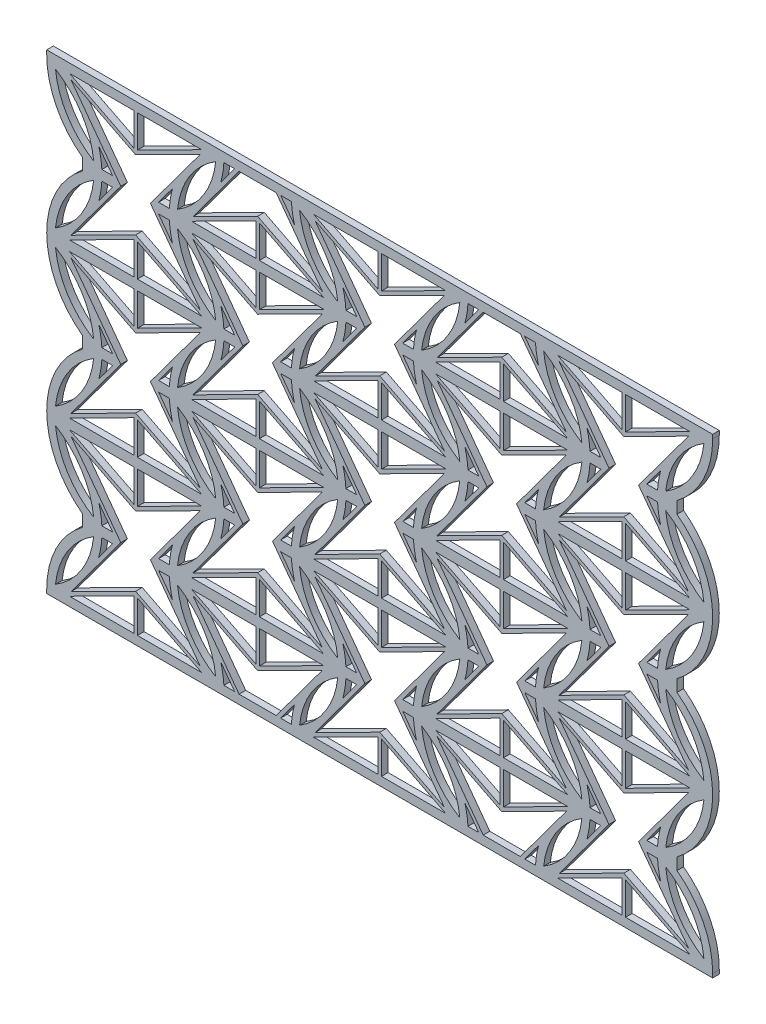
from build123d import *

# Parameters (mm, degrees)
BOSS_EXTRUDE1_DEPTH = 1.2


with BuildPart() as part:
    # Sketch1 → Boss-Extrude1 (new body)
    with BuildSketch(Plane.XY):
        with BuildLine():
            Line((-16.888522067, -14.63324126), (-16.888522067, -15.349692912))
            Line((-16.888522067, -15.349692912), (15.311477933, -15.349692912))
            Line((15.311477933, -15.349692912), (27.326374873, -15.349692912))
            Line((27.326374873, -15.349692912), (59.526374873, -15.349692912))
            Line((59.526374873, -15.349692912), (71.541271813, -15.349692912))
            Line((71.541271813, -15.349692912), (103.741271813, -15.349692912))
            Line((103.741271813, -15.349692912), (103.741271813, -14.63324126))
            ThreePointArc((103.741271813, -14.63324126), (102.035545018, -7.42110573), (97.279793689, -1.737160613))
            Line((97.279793689, -1.737160613), (97.279793689, 0.422957167))
            ThreePointArc((97.279793689, 0.422957167), (102.035545018, 6.106902284), (103.741271813, 13.319037814))
            ThreePointArc((103.741271813, 13.319037814), (102.035545018, 20.531173344), (97.279793689, 26.215118461))
            Line((97.279793689, 26.215118461), (97.279793689, 28.375236241))
            ThreePointArc((97.279793689, 28.375236241), (102.035545018, 34.059181358), (103.741271813, 41.271316888))
            ThreePointArc((103.741271813, 41.271316888), (102.035545018, 48.483452418), (97.279793689, 54.167397535))
            Line((97.279793689, 54.167397535), (97.279793689, 56.327515315))
            ThreePointArc((97.279793689, 56.327515315), (102.035545018, 62.011460432), (103.741271813, 69.223595962))
            Line((103.741271813, 69.223595962), (103.741271813, 69.940047614))
            Line((103.741271813, 69.940047614), (71.541271813, 69.940047614))
            Line((71.541271813, 69.940047614), (59.526374873, 69.940047614))
            Line((59.526374873, 69.940047614), (27.326374873, 69.940047614))
            Line((27.326374873, 69.940047614), (15.311477933, 69.940047614))
            Line((15.311477933, 69.940047614), (-16.888522067, 69.940047614))
            Line((-16.888522067, 69.940047614), (-16.888522067, 69.223595962))
            ThreePointArc((-16.888522067, 69.223595962), (-15.182795272, 62.011460432), (-10.427043943, 56.327515315))
            Line((-10.427043943, 56.327515315), (-10.427043943, 54.167397535))
            ThreePointArc((-10.427043943, 54.167397535), (-15.182795272, 48.483452418), (-16.888522067, 41.271316888))
            ThreePointArc((-16.888522067, 41.271316888), (-15.182795272, 34.059181358), (-10.427043943, 28.375236241))
            Line((-10.427043943, 28.375236241), (-10.427043943, 26.215118461))
            ThreePointArc((-10.427043943, 26.215118461), (-15.182795272, 20.531173344), (-16.888522067, 13.319037814))
            ThreePointArc((-16.888522067, 13.319037814), (-15.182795272, 6.106902284), (-10.427043943, 0.422957167))
            Line((-10.427043943, 0.422957167), (-10.427043943, -1.737160613))
            ThreePointArc((-10.427043943, -1.737160613), (-15.182795272, -7.42110573), (-16.888522067, -14.63324126))
        make_face()
        with BuildLine():
            Line((3.377612022, -1.575633744), (5.326519848, -1.575633744))
            ThreePointArc((5.326519848, -1.575633744), (5.517908163, -3.289323422), (5.892390802, -4.972512228))
            Line((5.892390802, -4.972512228), (3.377612022, -1.575633744))
        make_face(mode=Mode.SUBTRACT)
        with BuildLine():
            Line((-4.954656156, -1.575633744), (-6.903563983, -1.575633744))
            ThreePointArc((-6.903563983, -1.575633744), (-7.094952298, -3.289323422), (-7.469434937, -4.972512228))
            Line((-7.469434937, -4.972512228), (-4.954656156, -1.575633744))
        make_face(mode=Mode.SUBTRACT)
        with BuildLine():
            Line((-4.954656156, 0.261430299), (-7.469434937, 3.658308782))
            ThreePointArc((-7.469434937, 3.658308782), (-7.094952298, 1.975119977), (-6.903563983, 0.261430299))
            Line((-6.903563983, 0.261430299), (-4.954656156, 0.261430299))
        make_face(mode=Mode.SUBTRACT)
        Polygon((11.175521023, 12.400505793), (-0.465082292, 12.400505793), (-0.465082292, 6.521256719), align=None, mode=Mode.SUBTRACT)
        with BuildLine():
            Line((3.377612022, 0.261430299), (5.892390802, 3.658308782))
            ThreePointArc((5.892390802, 3.658308782), (5.517908163, 1.975119977), (5.326519848, 0.261430299))
            Line((5.326519848, 0.261430299), (3.377612022, 0.261430299))
        make_face(mode=Mode.SUBTRACT)
        Polygon((-1.111961843, 6.521256719), (-12.752565158, 12.400505793), (-1.111961843, 12.400505793), align=None, mode=Mode.SUBTRACT)
        Polygon((-0.788522067, -6.94739817), (10.931987496, -12.867005009), (1.89274578, -0.657101723), (10.931987496, 11.552801564), (-0.788522067, 5.633194724), (-12.509031631, 11.552801564), (-3.469789914, -0.657101723), (-12.509031631, -12.867005009), align=None, mode=Mode.SUBTRACT)
        Polygon((-0.465082292, -7.835460164), (11.175521023, -13.714709238), (-0.465082292, -13.714709238), align=None, mode=Mode.SUBTRACT)
        Polygon((-1.111961843, -13.714709238), (-1.111961843, -7.835460164), (-12.752565158, -13.714709238), align=None, mode=Mode.SUBTRACT)
        with BuildLine():
            Line((25.485060492, 14.237569836), (27.433968319, 14.237569836))
            ThreePointArc((27.433968319, 14.237569836), (27.625356634, 15.951259514), (27.999839272, 17.634448319))
            Line((27.999839272, 17.634448319), (25.485060492, 14.237569836))
        make_face(mode=Mode.SUBTRACT)
        Polygon((33.282969493, 0.261430299), (21.642366179, 0.261430299), (21.642366179, 6.140679373), align=None, mode=Mode.SUBTRACT)
        Polygon((21.318926403, 19.609334261), (9.598416839, 25.528941101), (18.637658556, 13.319037814), (9.598416839, 1.109134527), (21.318926403, 7.028741367), (33.039435966, 1.109134527), (24.00019425, 13.319037814), (33.039435966, 25.528941101), align=None, mode=Mode.SUBTRACT)
        with BuildLine():
            Line((17.152792314, 14.237569836), (15.203884487, 14.237569836))
            ThreePointArc((15.203884487, 14.237569836), (15.012496172, 15.951259514), (14.638013534, 17.634448319))
            Line((14.638013534, 17.634448319), (17.152792314, 14.237569836))
        make_face(mode=Mode.SUBTRACT)
        Polygon((20.995486627, 0.261430299), (9.354883312, 0.261430299), (20.995486627, 6.140679373), align=None, mode=Mode.SUBTRACT)
        with BuildLine():
            Line((17.152792314, 12.400505793), (15.203884487, 12.400505793))
            ThreePointArc((15.203884487, 12.400505793), (15.012496172, 10.686816114), (14.638013534, 9.003627309))
            Line((14.638013534, 9.003627309), (17.152792314, 12.400505793))
        make_face(mode=Mode.SUBTRACT)
        with BuildLine():
            Line((25.485060492, 12.400505793), (27.433968319, 12.400505793))
            ThreePointArc((27.433968319, 12.400505793), (27.625356634, 10.686816114), (27.999839272, 9.003627309))
            Line((27.999839272, 9.003627309), (25.485060492, 12.400505793))
        make_face(mode=Mode.SUBTRACT)
        Polygon((33.282969493, 26.376645329), (21.642366179, 26.376645329), (21.642366179, 20.497396255), align=None, mode=Mode.SUBTRACT)
        Polygon((20.995486627, 20.497396255), (9.354883312, 26.376645329), (20.995486627, 26.376645329), align=None, mode=Mode.SUBTRACT)
        with BuildLine():
            Line((47.592508962, 28.213709372), (49.541416789, 28.213709372))
            ThreePointArc((49.541416789, 28.213709372), (49.732805104, 29.927399051), (50.107287742, 31.610587856))
            Line((50.107287742, 31.610587856), (47.592508962, 28.213709372))
        make_face(mode=Mode.SUBTRACT)
        Polygon((55.390417964, 14.237569836), (43.749814649, 14.237569836), (43.749814649, 20.11681891), align=None, mode=Mode.SUBTRACT)
        Polygon((43.426374873, 33.585473798), (31.705865309, 39.505080638), (40.745107026, 27.295177351), (31.705865309, 15.085274064), (43.426374873, 21.004880904), (55.146884437, 15.085274064), (46.10764272, 27.295177351), (55.146884437, 39.505080638), align=None, mode=Mode.SUBTRACT)
        with BuildLine():
            Line((39.260240784, 28.213709372), (37.311332957, 28.213709372))
            ThreePointArc((37.311332957, 28.213709372), (37.119944642, 29.927399051), (36.745462004, 31.610587856))
            Line((36.745462004, 31.610587856), (39.260240784, 28.213709372))
        make_face(mode=Mode.SUBTRACT)
        Polygon((43.102935097, 14.237569836), (31.462331782, 14.237569836), (43.102935097, 20.11681891), align=None, mode=Mode.SUBTRACT)
        with BuildLine():
            Line((39.260240784, 26.376645329), (37.311332957, 26.376645329))
            ThreePointArc((37.311332957, 26.376645329), (37.119944642, 24.662955651), (36.745462004, 22.979766846))
            Line((36.745462004, 22.979766846), (39.260240784, 26.376645329))
        make_face(mode=Mode.SUBTRACT)
        with BuildLine():
            Line((47.592508962, 26.376645329), (49.541416789, 26.376645329))
            ThreePointArc((49.541416789, 26.376645329), (49.732805104, 24.662955651), (50.107287742, 22.979766846))
            Line((50.107287742, 22.979766846), (47.592508962, 26.376645329))
        make_face(mode=Mode.SUBTRACT)
        Polygon((55.390417964, 40.352784866), (43.749814649, 40.352784866), (43.749814649, 34.473535792), align=None, mode=Mode.SUBTRACT)
        Polygon((43.102935097, 34.473535792), (31.462331782, 40.352784866), (43.102935097, 40.352784866), align=None, mode=Mode.SUBTRACT)
        with BuildLine():
            Line((69.699957432, 42.189848909), (71.648865259, 42.189848909))
            ThreePointArc((71.648865259, 42.189848909), (71.840253574, 43.903538587), (72.214736212, 45.586727393))
            Line((72.214736212, 45.586727393), (69.699957432, 42.189848909))
        make_face(mode=Mode.SUBTRACT)
        Polygon((77.497866434, 28.213709372), (65.857263119, 28.213709372), (65.857263119, 34.092958446), align=None, mode=Mode.SUBTRACT)
        Polygon((65.533823343, 47.561613335), (53.81331378, 53.481220174), (62.852555496, 41.271316888), (53.81331378, 29.061413601), (65.533823343, 34.981020441), (77.254332907, 29.061413601), (68.21509119, 41.271316888), (77.254332907, 53.481220174), align=None, mode=Mode.SUBTRACT)
        with BuildLine():
            Line((61.367689254, 42.189848909), (59.418781427, 42.189848909))
            ThreePointArc((59.418781427, 42.189848909), (59.227393112, 43.903538587), (58.852910474, 45.586727393))
            Line((58.852910474, 45.586727393), (61.367689254, 42.189848909))
        make_face(mode=Mode.SUBTRACT)
        Polygon((65.210383567, 28.213709372), (53.569780253, 28.213709372), (65.210383567, 34.092958446), align=None, mode=Mode.SUBTRACT)
        with BuildLine():
            Line((61.367689254, 40.352784866), (59.418781427, 40.352784866))
            ThreePointArc((59.418781427, 40.352784866), (59.227393112, 38.639095188), (58.852910474, 36.955906383))
            Line((58.852910474, 36.955906383), (61.367689254, 40.352784866))
        make_face(mode=Mode.SUBTRACT)
        with BuildLine():
            Line((69.699957432, 40.352784866), (71.648865259, 40.352784866))
            ThreePointArc((71.648865259, 40.352784866), (71.840253574, 38.639095188), (72.214736212, 36.955906383))
            Line((72.214736212, 36.955906383), (69.699957432, 40.352784866))
        make_face(mode=Mode.SUBTRACT)
        Polygon((77.497866434, 54.328924403), (65.857263119, 54.328924403), (65.857263119, 48.449675329), align=None, mode=Mode.SUBTRACT)
        Polygon((65.210383567, 48.449675329), (53.569780253, 54.328924403), (65.210383567, 54.328924403), align=None, mode=Mode.SUBTRACT)
        with BuildLine():
            Line((91.807405902, 56.165988446), (93.756313729, 56.165988446))
            ThreePointArc((93.756313729, 56.165988446), (93.947702044, 57.879678124), (94.322184683, 59.56286693))
            Line((94.322184683, 59.56286693), (91.807405902, 56.165988446))
        make_face(mode=Mode.SUBTRACT)
        Polygon((99.605314904, 42.189848909), (87.964711589, 42.189848909), (87.964711589, 48.069097983), align=None, mode=Mode.SUBTRACT)
        Polygon((87.641271813, 61.537752872), (75.92076225, 67.457359711), (84.960003967, 55.247456425), (75.92076225, 43.037553138), (87.641271813, 48.957159978), (99.361781377, 43.037553138), (90.32253966, 55.247456425), (99.361781377, 67.457359711), align=None, mode=Mode.SUBTRACT)
        with BuildLine():
            Line((83.475137724, 56.165988446), (81.526229898, 56.165988446))
            ThreePointArc((81.526229898, 56.165988446), (81.334841583, 57.879678124), (80.960358944, 59.56286693))
            Line((80.960358944, 59.56286693), (83.475137724, 56.165988446))
        make_face(mode=Mode.SUBTRACT)
        Polygon((87.317832038, 42.189848909), (75.677228723, 42.189848909), (87.317832038, 48.069097983), align=None, mode=Mode.SUBTRACT)
        with BuildLine():
            Line((83.475137724, 54.328924403), (81.526229898, 54.328924403))
            ThreePointArc((81.526229898, 54.328924403), (81.334841583, 52.615234725), (80.960358944, 50.93204592))
            Line((80.960358944, 50.93204592), (83.475137724, 54.328924403))
        make_face(mode=Mode.SUBTRACT)
        with BuildLine():
            Line((91.807405902, 54.328924403), (93.756313729, 54.328924403))
            ThreePointArc((93.756313729, 54.328924403), (93.947702044, 52.615234725), (94.322184683, 50.93204592))
            Line((94.322184683, 50.93204592), (91.807405902, 54.328924403))
        make_face(mode=Mode.SUBTRACT)
        Polygon((99.605314904, 68.30506394), (87.964711589, 68.30506394), (87.964711589, 62.425814866), align=None, mode=Mode.SUBTRACT)
        Polygon((87.317832038, 62.425814866), (75.677228723, 68.30506394), (87.317832038, 68.30506394), align=None, mode=Mode.SUBTRACT)
        Polygon((20.995486627, 48.449675329), (9.354883312, 54.328924403), (20.995486627, 54.328924403), align=None, mode=Mode.SUBTRACT)
        with BuildLine():
            Line((17.152792314, 40.352784866), (15.203884487, 40.352784866))
            ThreePointArc((15.203884487, 40.352784866), (15.012496172, 38.639095188), (14.638013534, 36.955906383))
            Line((14.638013534, 36.955906383), (17.152792314, 40.352784866))
        make_face(mode=Mode.SUBTRACT)
        Polygon((21.642366179, 54.328924403), (21.642366179, 48.449675329), (33.282969493, 54.328924403), align=None, mode=Mode.SUBTRACT)
        Polygon((33.282969493, 28.213709372), (21.642366179, 28.213709372), (21.642366179, 34.092958446), align=None, mode=Mode.SUBTRACT)
        Polygon((21.318926403, 34.981020441), (33.039435966, 29.061413601), (24.00019425, 41.271316888), (33.039435966, 53.481220174), (21.318926403, 47.561613335), (9.598416839, 53.481220174), (18.637658556, 41.271316888), (9.598416839, 29.061413601), align=None, mode=Mode.SUBTRACT)
        with BuildLine():
            Line((17.152792314, 42.189848909), (15.203884487, 42.189848909))
            ThreePointArc((15.203884487, 42.189848909), (15.012496172, 43.903538587), (14.638013534, 45.586727393))
            Line((14.638013534, 45.586727393), (17.152792314, 42.189848909))
        make_face(mode=Mode.SUBTRACT)
        with BuildLine():
            Line((25.485060492, 40.352784866), (27.433968319, 40.352784866))
            ThreePointArc((27.433968319, 40.352784866), (27.625356634, 38.639095188), (27.999839272, 36.955906383))
            Line((27.999839272, 36.955906383), (25.485060492, 40.352784866))
        make_face(mode=Mode.SUBTRACT)
        Polygon((20.995486627, 34.092958446), (9.354883312, 28.213709372), (20.995486627, 28.213709372), align=None, mode=Mode.SUBTRACT)
        with BuildLine():
            Line((25.485060492, 42.189848909), (27.433968319, 42.189848909))
            ThreePointArc((27.433968319, 42.189848909), (27.625356634, 43.903538587), (27.999839272, 45.586727393))
            Line((27.999839272, 45.586727393), (25.485060492, 42.189848909))
        make_face(mode=Mode.SUBTRACT)
        Polygon((43.102935097, 62.425814866), (31.462331782, 68.30506394), (43.102935097, 68.30506394), align=None, mode=Mode.SUBTRACT)
        with BuildLine():
            Line((39.260240784, 54.328924403), (37.311332957, 54.328924403))
            ThreePointArc((37.311332957, 54.328924403), (37.119944642, 52.615234725), (36.745462004, 50.93204592))
            Line((36.745462004, 50.93204592), (39.260240784, 54.328924403))
        make_face(mode=Mode.SUBTRACT)
        Polygon((43.749814649, 68.30506394), (43.749814649, 62.425814866), (55.390417964, 68.30506394), align=None, mode=Mode.SUBTRACT)
        Polygon((55.390417964, 42.189848909), (43.749814649, 42.189848909), (43.749814649, 48.069097983), align=None, mode=Mode.SUBTRACT)
        Polygon((43.426374873, 48.957159978), (55.146884437, 43.037553138), (46.10764272, 55.247456425), (55.146884437, 67.457359711), (43.426374873, 61.537752872), (31.705865309, 67.457359711), (40.745107026, 55.247456425), (31.705865309, 43.037553138), align=None, mode=Mode.SUBTRACT)
        with BuildLine():
            Line((39.260240784, 56.165988446), (37.311332957, 56.165988446))
            ThreePointArc((37.311332957, 56.165988446), (37.119944642, 57.879678124), (36.745462004, 59.56286693))
            Line((36.745462004, 59.56286693), (39.260240784, 56.165988446))
        make_face(mode=Mode.SUBTRACT)
        with BuildLine():
            Line((47.592508962, 54.328924403), (49.541416789, 54.328924403))
            ThreePointArc((49.541416789, 54.328924403), (49.732805104, 52.615234725), (50.107287742, 50.93204592))
            Line((50.107287742, 50.93204592), (47.592508962, 54.328924403))
        make_face(mode=Mode.SUBTRACT)
        Polygon((43.102935097, 48.069097983), (31.462331782, 42.189848909), (43.102935097, 42.189848909), align=None, mode=Mode.SUBTRACT)
        with BuildLine():
            Line((47.592508962, 56.165988446), (49.541416789, 56.165988446))
            ThreePointArc((49.541416789, 56.165988446), (49.732805104, 57.879678124), (50.107287742, 59.56286693))
            Line((50.107287742, 59.56286693), (47.592508962, 56.165988446))
        make_face(mode=Mode.SUBTRACT)
        with BuildLine():
            Line((61.367689254, 68.30506394), (59.418781427, 68.30506394))
            ThreePointArc((59.418781427, 68.30506394), (59.227393112, 66.591374262), (58.852910474, 64.908185457))
            Line((58.852910474, 64.908185457), (61.367689254, 68.30506394))
        make_face(mode=Mode.SUBTRACT)
        Polygon((77.497866434, 56.165988446), (65.857263119, 56.165988446), (65.857263119, 62.04523752), align=None, mode=Mode.SUBTRACT)
        Polygon((65.533823343, 62.933299515), (77.254332907, 57.013692675), (68.895099276, 68.30506394), (62.17254741, 68.30506394), (53.81331378, 57.013692675), align=None, mode=Mode.SUBTRACT)
        with BuildLine():
            Line((69.699957432, 68.30506394), (71.648865259, 68.30506394))
            ThreePointArc((71.648865259, 68.30506394), (71.840253574, 66.591374262), (72.214736212, 64.908185457))
            Line((72.214736212, 64.908185457), (69.699957432, 68.30506394))
        make_face(mode=Mode.SUBTRACT)
        Polygon((65.210383567, 62.04523752), (53.569780253, 56.165988446), (65.210383567, 56.165988446), align=None, mode=Mode.SUBTRACT)
        Polygon((-1.111961843, 34.473535792), (-12.752565158, 40.352784866), (-1.111961843, 40.352784866), align=None, mode=Mode.SUBTRACT)
        with BuildLine():
            Line((-4.954656156, 26.376645329), (-6.903563983, 26.376645329))
            ThreePointArc((-6.903563983, 26.376645329), (-7.094952298, 24.662955651), (-7.469434937, 22.979766846))
            Line((-7.469434937, 22.979766846), (-4.954656156, 26.376645329))
        make_face(mode=Mode.SUBTRACT)
        Polygon((-0.465082292, 40.352784866), (-0.465082292, 34.473535792), (11.175521023, 40.352784866), align=None, mode=Mode.SUBTRACT)
        Polygon((11.175521023, 14.237569836), (-0.465082292, 14.237569836), (-0.465082292, 20.11681891), align=None, mode=Mode.SUBTRACT)
        Polygon((-0.788522067, 21.004880904), (10.931987496, 15.085274064), (1.89274578, 27.295177351), (10.931987496, 39.505080638), (-0.788522067, 33.585473798), (-12.509031631, 39.505080638), (-3.469789914, 27.295177351), (-12.509031631, 15.085274064), align=None, mode=Mode.SUBTRACT)
        with BuildLine():
            Line((-4.954656156, 28.213709372), (-6.903563983, 28.213709372))
            ThreePointArc((-6.903563983, 28.213709372), (-7.094952298, 29.927399051), (-7.469434937, 31.610587856))
            Line((-7.469434937, 31.610587856), (-4.954656156, 28.213709372))
        make_face(mode=Mode.SUBTRACT)
        with BuildLine():
            Line((3.377612022, 26.376645329), (5.326519848, 26.376645329))
            ThreePointArc((5.326519848, 26.376645329), (5.517908163, 24.662955651), (5.892390802, 22.979766846))
            Line((5.892390802, 22.979766846), (3.377612022, 26.376645329))
        make_face(mode=Mode.SUBTRACT)
        Polygon((-1.111961843, 20.11681891), (-12.752565158, 14.237569836), (-1.111961843, 14.237569836), align=None, mode=Mode.SUBTRACT)
        with BuildLine():
            Line((3.377612022, 28.213709372), (5.326519848, 28.213709372))
            ThreePointArc((5.326519848, 28.213709372), (5.517908163, 29.927399051), (5.892390802, 31.610587856))
            Line((5.892390802, 31.610587856), (3.377612022, 28.213709372))
        make_face(mode=Mode.SUBTRACT)
        Polygon((-1.111961843, 62.425814866), (-12.752565158, 68.30506394), (-1.111961843, 68.30506394), align=None, mode=Mode.SUBTRACT)
        with BuildLine():
            Line((-4.954656156, 54.328924403), (-6.903563983, 54.328924403))
            ThreePointArc((-6.903563983, 54.328924403), (-7.094952298, 52.615234725), (-7.469434937, 50.93204592))
            Line((-7.469434937, 50.93204592), (-4.954656156, 54.328924403))
        make_face(mode=Mode.SUBTRACT)
        Polygon((-0.465082292, 68.30506394), (-0.465082292, 62.425814866), (11.175521023, 68.30506394), align=None, mode=Mode.SUBTRACT)
        Polygon((11.175521023, 42.189848909), (-0.465082292, 42.189848909), (-0.465082292, 48.069097983), align=None, mode=Mode.SUBTRACT)
        Polygon((-0.788522067, 48.957159978), (10.931987496, 43.037553138), (1.89274578, 55.247456425), (10.931987496, 67.457359711), (-0.788522067, 61.537752872), (-12.509031631, 67.457359711), (-3.469789914, 55.247456425), (-12.509031631, 43.037553138), align=None, mode=Mode.SUBTRACT)
        with BuildLine():
            Line((-4.954656156, 56.165988446), (-6.903563983, 56.165988446))
            ThreePointArc((-6.903563983, 56.165988446), (-7.094952298, 57.879678124), (-7.469434937, 59.56286693))
            Line((-7.469434937, 59.56286693), (-4.954656156, 56.165988446))
        make_face(mode=Mode.SUBTRACT)
        with BuildLine():
            Line((3.377612022, 54.328924403), (5.326519848, 54.328924403))
            ThreePointArc((5.326519848, 54.328924403), (5.517908163, 52.615234725), (5.892390802, 50.93204592))
            Line((5.892390802, 50.93204592), (3.377612022, 54.328924403))
        make_face(mode=Mode.SUBTRACT)
        Polygon((-1.111961843, 48.069097983), (-12.752565158, 42.189848909), (-1.111961843, 42.189848909), align=None, mode=Mode.SUBTRACT)
        with BuildLine():
            Line((3.377612022, 56.165988446), (5.326519848, 56.165988446))
            ThreePointArc((5.326519848, 56.165988446), (5.517908163, 57.879678124), (5.892390802, 59.56286693))
            Line((5.892390802, 59.56286693), (3.377612022, 56.165988446))
        make_face(mode=Mode.SUBTRACT)
        with BuildLine():
            Line((17.152792314, 68.30506394), (15.203884487, 68.30506394))
            ThreePointArc((15.203884487, 68.30506394), (15.012496172, 66.591374262), (14.638013534, 64.908185457))
            Line((14.638013534, 64.908185457), (17.152792314, 68.30506394))
        make_face(mode=Mode.SUBTRACT)
        Polygon((33.282969493, 56.165988446), (21.642366179, 56.165988446), (21.642366179, 62.04523752), align=None, mode=Mode.SUBTRACT)
        Polygon((21.318926403, 62.933299515), (33.039435966, 57.013692675), (24.680202336, 68.30506394), (17.95765047, 68.30506394), (9.598416839, 57.013692675), align=None, mode=Mode.SUBTRACT)
        with BuildLine():
            Line((25.485060492, 68.30506394), (27.433968319, 68.30506394))
            ThreePointArc((27.433968319, 68.30506394), (27.625356634, 66.591374262), (27.999839272, 64.908185457))
            Line((27.999839272, 64.908185457), (25.485060492, 68.30506394))
        make_face(mode=Mode.SUBTRACT)
        Polygon((20.995486627, 62.04523752), (9.354883312, 56.165988446), (20.995486627, 56.165988446), align=None, mode=Mode.SUBTRACT)
        with BuildLine():
            Line((39.260240784, 0.261430299), (36.745462004, 3.658308782))
            ThreePointArc((36.745462004, 3.658308782), (37.119944642, 1.975119977), (37.311332957, 0.261430299))
            Line((37.311332957, 0.261430299), (39.260240784, 0.261430299))
        make_face(mode=Mode.SUBTRACT)
        Polygon((43.102935097, -13.714709238), (43.102935097, -7.835460164), (31.462331782, -13.714709238), align=None, mode=Mode.SUBTRACT)
        Polygon((55.390417964, 12.400505793), (43.749814649, 12.400505793), (43.749814649, 6.521256719), align=None, mode=Mode.SUBTRACT)
        Polygon((43.749814649, -13.714709238), (43.749814649, -7.835460164), (55.390417964, -13.714709238), align=None, mode=Mode.SUBTRACT)
        with BuildLine():
            Line((39.260240784, -1.575633744), (36.745462004, -4.972512228))
            ThreePointArc((36.745462004, -4.972512228), (37.119944642, -3.289323422), (37.311332957, -1.575633744))
            Line((37.311332957, -1.575633744), (39.260240784, -1.575633744))
        make_face(mode=Mode.SUBTRACT)
        with BuildLine():
            Line((47.592508962, 0.261430299), (50.107287742, 3.658308782))
            ThreePointArc((50.107287742, 3.658308782), (49.732805104, 1.975119977), (49.541416789, 0.261430299))
            Line((49.541416789, 0.261430299), (47.592508962, 0.261430299))
        make_face(mode=Mode.SUBTRACT)
        Polygon((43.102935097, 12.400505793), (43.102935097, 6.521256719), (31.462331782, 12.400505793), align=None, mode=Mode.SUBTRACT)
        Polygon((55.146884437, -12.867005009), (46.10764272, -0.657101723), (55.146884437, 11.552801564), (43.426374873, 5.633194724), (31.705865309, 11.552801564), (40.745107026, -0.657101723), (31.705865309, -12.867005009), (43.426374873, -6.94739817), align=None, mode=Mode.SUBTRACT)
        with BuildLine():
            Line((47.592508962, -1.575633744), (49.541416789, -1.575633744))
            ThreePointArc((49.541416789, -1.575633744), (49.732805104, -3.289323422), (50.107287742, -4.972512228))
            Line((50.107287742, -4.972512228), (47.592508962, -1.575633744))
        make_face(mode=Mode.SUBTRACT)
        with BuildLine():
            Line((61.367689254, 14.237569836), (58.852910474, 17.634448319))
            ThreePointArc((58.852910474, 17.634448319), (59.227393112, 15.951259514), (59.418781427, 14.237569836))
            Line((59.418781427, 14.237569836), (61.367689254, 14.237569836))
        make_face(mode=Mode.SUBTRACT)
        Polygon((65.210383567, 0.261430299), (65.210383567, 6.140679373), (53.569780253, 0.261430299), align=None, mode=Mode.SUBTRACT)
        Polygon((77.497866434, 26.376645329), (65.857263119, 26.376645329), (65.857263119, 20.497396255), align=None, mode=Mode.SUBTRACT)
        Polygon((65.857263119, 0.261430299), (65.857263119, 6.140679373), (77.497866434, 0.261430299), align=None, mode=Mode.SUBTRACT)
        with BuildLine():
            Line((61.367689254, 12.400505793), (58.852910474, 9.003627309))
            ThreePointArc((58.852910474, 9.003627309), (59.227393112, 10.686816114), (59.418781427, 12.400505793))
            Line((59.418781427, 12.400505793), (61.367689254, 12.400505793))
        make_face(mode=Mode.SUBTRACT)
        with BuildLine():
            Line((69.699957432, 14.237569836), (72.214736212, 17.634448319))
            ThreePointArc((72.214736212, 17.634448319), (71.840253574, 15.951259514), (71.648865259, 14.237569836))
            Line((71.648865259, 14.237569836), (69.699957432, 14.237569836))
        make_face(mode=Mode.SUBTRACT)
        Polygon((65.210383567, 26.376645329), (65.210383567, 20.497396255), (53.569780253, 26.376645329), align=None, mode=Mode.SUBTRACT)
        Polygon((77.254332907, 1.109134527), (68.21509119, 13.319037814), (77.254332907, 25.528941101), (65.533823343, 19.609334261), (53.81331378, 25.528941101), (62.852555496, 13.319037814), (53.81331378, 1.109134527), (65.533823343, 7.028741367), align=None, mode=Mode.SUBTRACT)
        with BuildLine():
            Line((69.699957432, 12.400505793), (71.648865259, 12.400505793))
            ThreePointArc((71.648865259, 12.400505793), (71.840253574, 10.686816114), (72.214736212, 9.003627309))
            Line((72.214736212, 9.003627309), (69.699957432, 12.400505793))
        make_face(mode=Mode.SUBTRACT)
        with BuildLine():
            Line((83.475137724, 28.213709372), (80.960358944, 31.610587856))
            ThreePointArc((80.960358944, 31.610587856), (81.334841583, 29.927399051), (81.526229898, 28.213709372))
            Line((81.526229898, 28.213709372), (83.475137724, 28.213709372))
        make_face(mode=Mode.SUBTRACT)
        Polygon((87.317832038, 14.237569836), (87.317832038, 20.11681891), (75.677228723, 14.237569836), align=None, mode=Mode.SUBTRACT)
        Polygon((99.605314904, 40.352784866), (87.964711589, 40.352784866), (87.964711589, 34.473535792), align=None, mode=Mode.SUBTRACT)
        Polygon((87.964711589, 14.237569836), (87.964711589, 20.11681891), (99.605314904, 14.237569836), align=None, mode=Mode.SUBTRACT)
        with BuildLine():
            Line((83.475137724, 26.376645329), (80.960358944, 22.979766846))
            ThreePointArc((80.960358944, 22.979766846), (81.334841583, 24.662955651), (81.526229898, 26.376645329))
            Line((81.526229898, 26.376645329), (83.475137724, 26.376645329))
        make_face(mode=Mode.SUBTRACT)
        with BuildLine():
            Line((91.807405902, 28.213709372), (94.322184683, 31.610587856))
            ThreePointArc((94.322184683, 31.610587856), (93.947702044, 29.927399051), (93.756313729, 28.213709372))
            Line((93.756313729, 28.213709372), (91.807405902, 28.213709372))
        make_face(mode=Mode.SUBTRACT)
        Polygon((87.317832038, 40.352784866), (87.317832038, 34.473535792), (75.677228723, 40.352784866), align=None, mode=Mode.SUBTRACT)
        Polygon((99.361781377, 15.085274064), (90.32253966, 27.295177351), (99.361781377, 39.505080638), (87.641271813, 33.585473798), (75.92076225, 39.505080638), (84.960003967, 27.295177351), (75.92076225, 15.085274064), (87.641271813, 21.004880904), align=None, mode=Mode.SUBTRACT)
        with BuildLine():
            Line((91.807405902, 26.376645329), (93.756313729, 26.376645329))
            ThreePointArc((93.756313729, 26.376645329), (93.947702044, 24.662955651), (94.322184683, 22.979766846))
            Line((94.322184683, 22.979766846), (91.807405902, 26.376645329))
        make_face(mode=Mode.SUBTRACT)
        with BuildLine():
            Line((83.475137724, 0.261430299), (80.960358944, 3.658308782))
            ThreePointArc((80.960358944, 3.658308782), (81.334841583, 1.975119977), (81.526229898, 0.261430299))
            Line((81.526229898, 0.261430299), (83.475137724, 0.261430299))
        make_face(mode=Mode.SUBTRACT)
        Polygon((87.317832038, -13.714709238), (87.317832038, -7.835460164), (75.677228723, -13.714709238), align=None, mode=Mode.SUBTRACT)
        Polygon((99.605314904, 12.400505793), (87.964711589, 12.400505793), (87.964711589, 6.521256719), align=None, mode=Mode.SUBTRACT)
        Polygon((87.964711589, -13.714709238), (87.964711589, -7.835460164), (99.605314904, -13.714709238), align=None, mode=Mode.SUBTRACT)
        with BuildLine():
            Line((83.475137724, -1.575633744), (80.960358944, -4.972512228))
            ThreePointArc((80.960358944, -4.972512228), (81.334841583, -3.289323422), (81.526229898, -1.575633744))
            Line((81.526229898, -1.575633744), (83.475137724, -1.575633744))
        make_face(mode=Mode.SUBTRACT)
        with BuildLine():
            Line((91.807405902, 0.261430299), (94.322184683, 3.658308782))
            ThreePointArc((94.322184683, 3.658308782), (93.947702044, 1.975119977), (93.756313729, 0.261430299))
            Line((93.756313729, 0.261430299), (91.807405902, 0.261430299))
        make_face(mode=Mode.SUBTRACT)
        Polygon((87.317832038, 12.400505793), (87.317832038, 6.521256719), (75.677228723, 12.400505793), align=None, mode=Mode.SUBTRACT)
        Polygon((99.361781377, -12.867005009), (90.32253966, -0.657101723), (99.361781377, 11.552801564), (87.641271813, 5.633194724), (75.92076225, 11.552801564), (84.960003967, -0.657101723), (75.92076225, -12.867005009), (87.641271813, -6.94739817), align=None, mode=Mode.SUBTRACT)
        with BuildLine():
            Line((91.807405902, -1.575633744), (93.756313729, -1.575633744))
            ThreePointArc((93.756313729, -1.575633744), (93.947702044, -3.289323422), (94.322184683, -4.972512228))
            Line((94.322184683, -4.972512228), (91.807405902, -1.575633744))
        make_face(mode=Mode.SUBTRACT)
        with BuildLine():
            Line((61.367689254, -13.714709238), (58.852910474, -10.317830755))
            ThreePointArc((58.852910474, -10.317830755), (59.227393112, -12.00101956), (59.418781427, -13.714709238))
            Line((59.418781427, -13.714709238), (61.367689254, -13.714709238))
        make_face(mode=Mode.SUBTRACT)
        Polygon((77.497866434, -1.575633744), (65.857263119, -1.575633744), (65.857263119, -7.454882818), align=None, mode=Mode.SUBTRACT)
        with BuildLine():
            Line((69.699957432, -13.714709238), (72.214736212, -10.317830755))
            ThreePointArc((72.214736212, -10.317830755), (71.840253574, -12.00101956), (71.648865259, -13.714709238))
            Line((71.648865259, -13.714709238), (69.699957432, -13.714709238))
        make_face(mode=Mode.SUBTRACT)
        Polygon((65.210383567, -1.575633744), (65.210383567, -7.454882818), (53.569780253, -1.575633744), align=None, mode=Mode.SUBTRACT)
        Polygon((65.533823343, -8.342944813), (53.81331378, -2.423337973), (62.17254741, -13.714709238), (68.895099276, -13.714709238), (77.254332907, -2.423337973), align=None, mode=Mode.SUBTRACT)
        with BuildLine():
            Line((17.152792314, -13.714709238), (14.638013534, -10.317830755))
            ThreePointArc((14.638013534, -10.317830755), (15.012496172, -12.00101956), (15.203884487, -13.714709238))
            Line((15.203884487, -13.714709238), (17.152792314, -13.714709238))
        make_face(mode=Mode.SUBTRACT)
        Polygon((33.282969493, -1.575633744), (21.642366179, -1.575633744), (21.642366179, -7.454882818), align=None, mode=Mode.SUBTRACT)
        with BuildLine():
            Line((25.485060492, -13.714709238), (27.999839272, -10.317830755))
            ThreePointArc((27.999839272, -10.317830755), (27.625356634, -12.00101956), (27.433968319, -13.714709238))
            Line((27.433968319, -13.714709238), (25.485060492, -13.714709238))
        make_face(mode=Mode.SUBTRACT)
        Polygon((20.995486627, -1.575633744), (20.995486627, -7.454882818), (9.354883312, -1.575633744), align=None, mode=Mode.SUBTRACT)
        Polygon((21.318926403, -8.342944813), (9.598416839, -2.423337973), (17.95765047, -13.714709238), (24.680202336, -13.714709238), (33.039435966, -2.423337973), align=None, mode=Mode.SUBTRACT)
        with BuildLine():
            ThreePointArc((6.806402608, -2.174044587), (11.545092531, -6.836035768), (13.724001727, -13.116298395))
            ThreePointArc((13.724001727, -13.116298395), (8.985311804, -8.454307215), (6.806402608, -2.174044587))
        make_face(mode=Mode.SUBTRACT)
        with BuildLine():
            ThreePointArc((-15.301045862, -13.116298395), (-10.562355939, -8.454307215), (-8.383446743, -2.174044587))
            ThreePointArc((-8.383446743, -2.174044587), (-13.122136666, -6.836035768), (-15.301045862, -13.116298395))
        make_face(mode=Mode.SUBTRACT)
        with BuildLine():
            ThreePointArc((6.806402608, 0.859841142), (11.545092531, 5.521832322), (13.724001727, 11.802094949))
            ThreePointArc((13.724001727, 11.802094949), (8.985311804, 7.140103769), (6.806402608, 0.859841142))
        make_face(mode=Mode.SUBTRACT)
        with BuildLine():
            ThreePointArc((-15.301045862, 11.802094949), (-10.562355939, 7.140103769), (-8.383446743, 0.859841142))
            ThreePointArc((-8.383446743, 0.859841142), (-13.122136666, 5.521832322), (-15.301045862, 11.802094949))
        make_face(mode=Mode.SUBTRACT)
        with BuildLine():
            ThreePointArc((35.831450198, 0.859841142), (31.092760275, 5.521832322), (28.913851078, 11.802094949))
            ThreePointArc((28.913851078, 11.802094949), (33.652541001, 7.140103769), (35.831450198, 0.859841142))
        make_face(mode=Mode.SUBTRACT)
        with BuildLine():
            ThreePointArc((35.831450198, 25.778234486), (31.092760275, 21.116243306), (28.913851078, 14.835980679))
            ThreePointArc((28.913851078, 14.835980679), (33.652541001, 19.497971859), (35.831450198, 25.778234486))
        make_face(mode=Mode.SUBTRACT)
        with BuildLine():
            ThreePointArc((57.938898668, 14.835980679), (53.200208745, 19.497971859), (51.021299549, 25.778234486))
            ThreePointArc((51.021299549, 25.778234486), (55.759989472, 21.116243306), (57.938898668, 14.835980679))
        make_face(mode=Mode.SUBTRACT)
        with BuildLine():
            ThreePointArc((57.938898668, 39.754374023), (53.200208745, 35.092382843), (51.021299549, 28.812120215))
            ThreePointArc((51.021299549, 28.812120215), (55.759989472, 33.474111396), (57.938898668, 39.754374023))
        make_face(mode=Mode.SUBTRACT)
        with BuildLine():
            ThreePointArc((80.046347138, 28.812120215), (75.307657215, 33.474111396), (73.128748019, 39.754374023))
            ThreePointArc((73.128748019, 39.754374023), (77.867437942, 35.092382843), (80.046347138, 28.812120215))
        make_face(mode=Mode.SUBTRACT)
        with BuildLine():
            ThreePointArc((80.046347138, 53.73051356), (75.307657215, 49.06852238), (73.128748019, 42.788259752))
            ThreePointArc((73.128748019, 42.788259752), (77.867437942, 47.450250933), (80.046347138, 53.73051356))
        make_face(mode=Mode.SUBTRACT)
        with BuildLine():
            ThreePointArc((102.153795608, 42.788259752), (97.415105685, 47.450250933), (95.236196489, 53.73051356))
            ThreePointArc((95.236196489, 53.73051356), (99.974886412, 49.06852238), (102.153795608, 42.788259752))
        make_face(mode=Mode.SUBTRACT)
        with BuildLine():
            ThreePointArc((102.153795608, 67.706653097), (97.415105685, 63.044661917), (95.236196489, 56.764399289))
            ThreePointArc((95.236196489, 56.764399289), (99.974886412, 61.42639047), (102.153795608, 67.706653097))
        make_face(mode=Mode.SUBTRACT)
        with BuildLine():
            ThreePointArc((13.724001727, 39.754374023), (8.985311804, 35.092382843), (6.806402608, 28.812120215))
            ThreePointArc((6.806402608, 28.812120215), (11.545092531, 33.474111396), (13.724001727, 39.754374023))
        make_face(mode=Mode.SUBTRACT)
        with BuildLine():
            ThreePointArc((35.831450198, 28.812120215), (31.092760275, 33.474111396), (28.913851078, 39.754374023))
            ThreePointArc((28.913851078, 39.754374023), (33.652541001, 35.092382843), (35.831450198, 28.812120215))
        make_face(mode=Mode.SUBTRACT)
        with BuildLine():
            ThreePointArc((35.831450198, 53.73051356), (31.092760275, 49.06852238), (28.913851078, 42.788259752))
            ThreePointArc((28.913851078, 42.788259752), (33.652541001, 47.450250933), (35.831450198, 53.73051356))
        make_face(mode=Mode.SUBTRACT)
        with BuildLine():
            ThreePointArc((51.021299549, 56.764399289), (55.759989472, 61.42639047), (57.938898668, 67.706653097))
            ThreePointArc((57.938898668, 67.706653097), (53.200208745, 63.044661917), (51.021299549, 56.764399289))
        make_face(mode=Mode.SUBTRACT)
        with BuildLine():
            ThreePointArc((57.938898668, 42.788259752), (53.200208745, 47.450250933), (51.021299549, 53.73051356))
            ThreePointArc((51.021299549, 53.73051356), (55.759989472, 49.06852238), (57.938898668, 42.788259752))
        make_face(mode=Mode.SUBTRACT)
        with BuildLine():
            ThreePointArc((80.046347138, 56.764399289), (75.307657215, 61.42639047), (73.128748019, 67.706653097))
            ThreePointArc((73.128748019, 67.706653097), (77.867437942, 63.044661917), (80.046347138, 56.764399289))
        make_face(mode=Mode.SUBTRACT)
        with BuildLine():
            ThreePointArc((-8.383446743, 25.778234486), (-13.122136666, 21.116243306), (-15.301045862, 14.835980679))
            ThreePointArc((-15.301045862, 14.835980679), (-10.562355939, 19.497971859), (-8.383446743, 25.778234486))
        make_face(mode=Mode.SUBTRACT)
        with BuildLine():
            ThreePointArc((-15.301045862, 39.754374023), (-10.562355939, 35.092382843), (-8.383446743, 28.812120215))
            ThreePointArc((-8.383446743, 28.812120215), (-13.122136666, 33.474111396), (-15.301045862, 39.754374023))
        make_face(mode=Mode.SUBTRACT)
        with BuildLine():
            ThreePointArc((13.724001727, 14.835980679), (8.985311804, 19.497971859), (6.806402608, 25.778234486))
            ThreePointArc((6.806402608, 25.778234486), (11.545092531, 21.116243306), (13.724001727, 14.835980679))
        make_face(mode=Mode.SUBTRACT)
        with BuildLine():
            ThreePointArc((-8.383446743, 53.73051356), (-13.122136666, 49.06852238), (-15.301045862, 42.788259752))
            ThreePointArc((-15.301045862, 42.788259752), (-10.562355939, 47.450250933), (-8.383446743, 53.73051356))
        make_face(mode=Mode.SUBTRACT)
        with BuildLine():
            ThreePointArc((6.806402608, 56.764399289), (11.545092531, 61.42639047), (13.724001727, 67.706653097))
            ThreePointArc((13.724001727, 67.706653097), (8.985311804, 63.044661917), (6.806402608, 56.764399289))
        make_face(mode=Mode.SUBTRACT)
        with BuildLine():
            ThreePointArc((-15.301045862, 67.706653097), (-10.562355939, 63.044661917), (-8.383446743, 56.764399289))
            ThreePointArc((-8.383446743, 56.764399289), (-13.122136666, 61.42639047), (-15.301045862, 67.706653097))
        make_face(mode=Mode.SUBTRACT)
        with BuildLine():
            ThreePointArc((13.724001727, 42.788259752), (8.985311804, 47.450250933), (6.806402608, 53.73051356))
            ThreePointArc((6.806402608, 53.73051356), (11.545092531, 49.06852238), (13.724001727, 42.788259752))
        make_face(mode=Mode.SUBTRACT)
        with BuildLine():
            ThreePointArc((35.831450198, 56.764399289), (31.092760275, 61.42639047), (28.913851078, 67.706653097))
            ThreePointArc((28.913851078, 67.706653097), (33.652541001, 63.044661917), (35.831450198, 56.764399289))
        make_face(mode=Mode.SUBTRACT)
        with BuildLine():
            ThreePointArc((51.021299549, -2.174044587), (55.759989472, -6.836035768), (57.938898668, -13.116298395))
            ThreePointArc((57.938898668, -13.116298395), (53.200208745, -8.454307215), (51.021299549, -2.174044587))
        make_face(mode=Mode.SUBTRACT)
        with BuildLine():
            ThreePointArc((51.021299549, 0.859841142), (55.759989472, 5.521832322), (57.938898668, 11.802094949))
            ThreePointArc((57.938898668, 11.802094949), (53.200208745, 7.140103769), (51.021299549, 0.859841142))
        make_face(mode=Mode.SUBTRACT)
        with BuildLine():
            ThreePointArc((73.128748019, 11.802094949), (77.867437942, 7.140103769), (80.046347138, 0.859841142))
            ThreePointArc((80.046347138, 0.859841142), (75.307657215, 5.521832322), (73.128748019, 11.802094949))
        make_face(mode=Mode.SUBTRACT)
        with BuildLine():
            ThreePointArc((73.128748019, 14.835980679), (77.867437942, 19.497971859), (80.046347138, 25.778234486))
            ThreePointArc((80.046347138, 25.778234486), (75.307657215, 21.116243306), (73.128748019, 14.835980679))
        make_face(mode=Mode.SUBTRACT)
        with BuildLine():
            ThreePointArc((95.236196489, 25.778234486), (99.974886412, 21.116243306), (102.153795608, 14.835980679))
            ThreePointArc((102.153795608, 14.835980679), (97.415105685, 19.497971859), (95.236196489, 25.778234486))
        make_face(mode=Mode.SUBTRACT)
        with BuildLine():
            ThreePointArc((95.236196489, 28.812120215), (99.974886412, 33.474111396), (102.153795608, 39.754374023))
            ThreePointArc((102.153795608, 39.754374023), (97.415105685, 35.092382843), (95.236196489, 28.812120215))
        make_face(mode=Mode.SUBTRACT)
        with BuildLine():
            ThreePointArc((95.236196489, -2.174044587), (99.974886412, -6.836035768), (102.153795608, -13.116298395))
            ThreePointArc((102.153795608, -13.116298395), (97.415105685, -8.454307215), (95.236196489, -2.174044587))
        make_face(mode=Mode.SUBTRACT)
        with BuildLine():
            ThreePointArc((95.236196489, 0.859841142), (99.974886412, 5.521832322), (102.153795608, 11.802094949))
            ThreePointArc((102.153795608, 11.802094949), (97.415105685, 7.140103769), (95.236196489, 0.859841142))
        make_face(mode=Mode.SUBTRACT)
        with BuildLine():
            ThreePointArc((73.128748019, -13.116298395), (77.867437942, -8.454307215), (80.046347138, -2.174044587))
            ThreePointArc((80.046347138, -2.174044587), (75.307657215, -6.836035768), (73.128748019, -13.116298395))
        make_face(mode=Mode.SUBTRACT)
        with BuildLine():
            ThreePointArc((28.913851078, -13.116298395), (33.652541001, -8.454307215), (35.831450198, -2.174044587))
            ThreePointArc((35.831450198, -2.174044587), (31.092760275, -6.836035768), (28.913851078, -13.116298395))
        make_face(mode=Mode.SUBTRACT)
    extrude(amount=BOSS_EXTRUDE1_DEPTH)


solid = part.part
